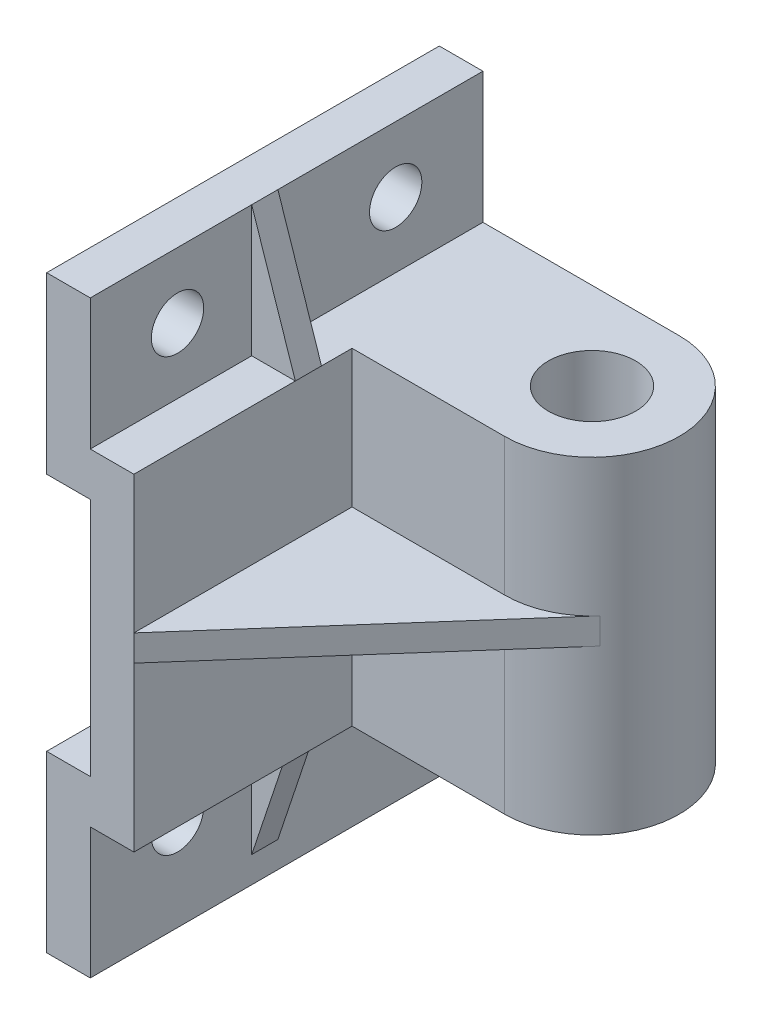
from build123d import *

# Parameters (mm, degrees)
Y_KSEKLIK_EKSTR_ZYON1_DEPTH    = 90
IZIM3_R                        = 10
Y_KSEKLIK_EKSTR_ZYON2_DEPTH    = 75
Y_KSEKLIK_EKSTR_ZYON3_START    = -37.5
Y_KSEKLIK_EKSTR_ZYON3_DEPTH    = 6
Y_KSEKLIK_EKSTR_ZYON4_START    = -37
Y_KSEKLIK_EKSTR_ZYON4_DEPTH    = 6
F_12_0_12_AP_DELIK1_AT_2_COUNT = 2
F_12_0_12_AP_DELIK1_AT_2_PITCH = 50


with BuildPart() as part:
    # Çizim2 → Yükseklik-Ekstrüzyon1 (new body)
    with BuildSketch(Plane.XY):
        Polygon((0, 0), (10, 0), (10, 30), (20, 30), (20, 105), (10, 105), (10, 135), (0, 135), (0, 95), (10, 95), (10, 40), (0, 40), align=None)
    extrude(amount=-Y_KSEKLIK_EKSTR_ZYON1_DEPTH)

    # Çizim3 → Yükseklik-Ekstrüzyon2 (add)
    with BuildSketch(Plane(origin=(0, 105, 0), x_dir=(1, 0, 0), z_dir=(0, 1, 0))):
        with BuildLine():
            Line((20, 90), (55, 90))
            ThreePointArc((55, 90), (75, 70), (55, 50))
            Line((55, 50), (20, 50))
            Line((20, 50), (20, 90))
        make_face()
        with Locations(Location((55, 70, 0), (0, 0, 180))):
            Circle(IZIM3_R, mode=Mode.SUBTRACT)
    extrude(amount=-Y_KSEKLIK_EKSTR_ZYON2_DEPTH)

    # Çizim7 → Yükseklik-Ekstrüzyon4 (add)
    with BuildSketch(Plane.XY.offset(Y_KSEKLIK_EKSTR_ZYON4_START)):
        Polygon((10, 135), (20, 105), (10, 105), align=None)
    y_kseklik_ekstr_zyon4 = extrude(amount=-Y_KSEKLIK_EKSTR_ZYON4_DEPTH)

    # Aynalama5: Yükseklik-Ekstrüzyon4 across plane
    add(y_kseklik_ekstr_zyon4.mirror(Plane.ZX.offset(70.5)))

    # Çizim10 → Ø12.0 (12) Çap Delik1 (revolve, cut)
    with BuildSketch(Plane(origin=(10, 120, -20), x_dir=(0, 0, -1), z_dir=(0, 1, 0))):
        Polygon((0, 0), (0, 13.605163714), (6, 10), (6, 0), align=None)
    f_12_0_12_ap_delik1 = revolve(axis=Axis((16.35, 120, -20), (-1, 0, 0)), mode=Mode.SUBTRACT)

    # Ø12.0 (12) Çap Delik1 at 2: Ø12.0 (12) Çap Delik1 ×2
    with Locations(*[(0, 0, -i * F_12_0_12_AP_DELIK1_AT_2_PITCH) for i in range(1, F_12_0_12_AP_DELIK1_AT_2_COUNT)]):
        add(f_12_0_12_ap_delik1, mode=Mode.SUBTRACT)

    # Aynalama6: Ø12.0 (12) Çap Delik1 across plane
    add(f_12_0_12_ap_delik1.mirror(Plane.ZX.offset(70.5)), mode=Mode.SUBTRACT)

    # Aynalama6 copy 1 sketch → Aynalama6 copy 1 (revolve, cut)
    with BuildSketch(Plane(origin=(10, 21, -70), x_dir=(0, 0, -1), z_dir=(0, -1, 0))):
        Polygon((0, 0), (0, -13.605163714), (6, -10), (6, 0), align=None)
    revolve(axis=Axis((16.35, 21, -70), (1, 0, 0)), mode=Mode.SUBTRACT)


with BuildPart() as body_2:
    # Çizim5 → Yükseklik-Ekstrüzyon3 (new body)
    with BuildSketch(Plane(origin=(0, 105, 0), x_dir=(1, 0, 0), z_dir=(0, 1, 0)).offset(Y_KSEKLIK_EKSTR_ZYON3_START)):
        with BuildLine():
            Line((20, 0), (70.008852515, 56.781288028))
            ThreePointArc((70.008852515, 56.781288028), (63.234857636, 51.773998801), (55, 50))
            Line((55, 50), (20, 50))
            Line((20, 50), (20, 0))
        make_face()
    extrude(amount=Y_KSEKLIK_EKSTR_ZYON3_DEPTH)


solid = Compound([part.part, body_2.part])
